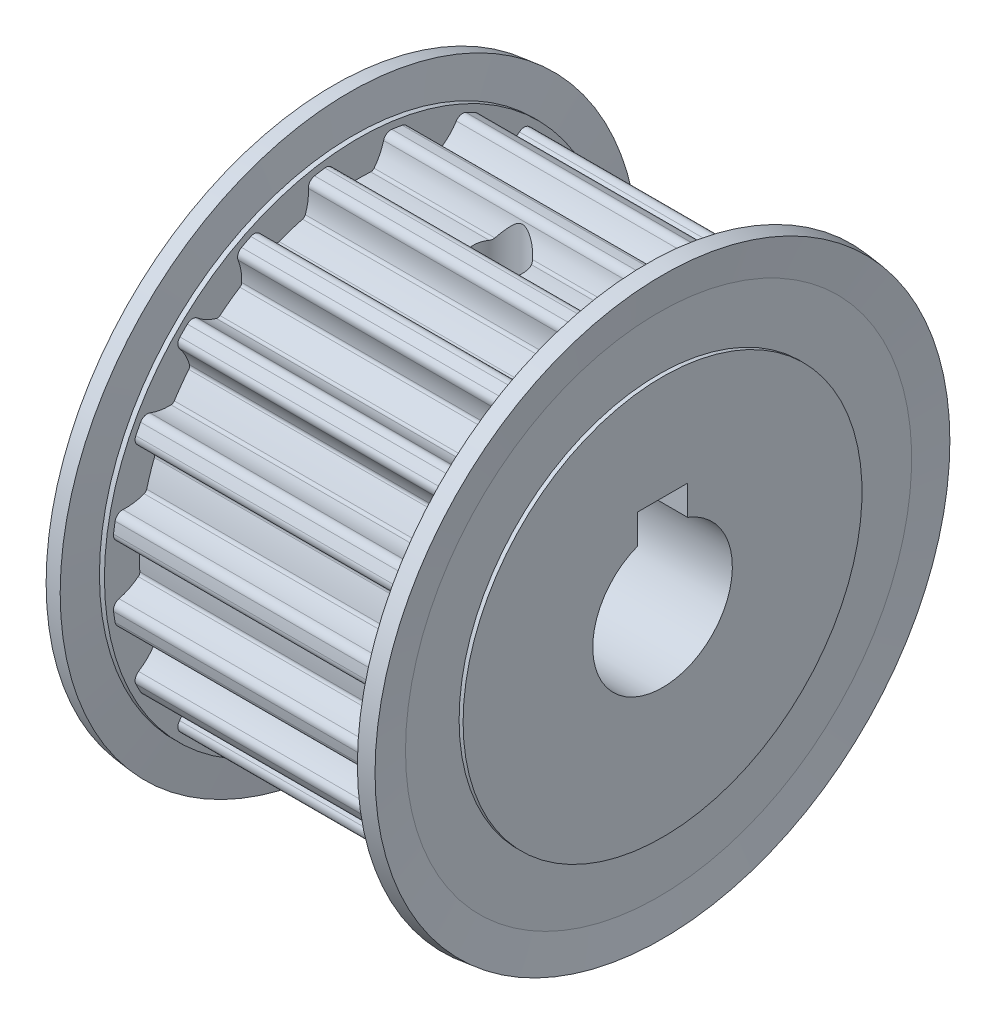
from build123d import *

# Parameters (mm, degrees)
SKETCH_2_W           = 33
SKETCH_2_H           = 29
CUT_EXTRUDE_1_DEPTH  = 28
CUT_EXTRUDE_2_DEPTH  = 28
CUT_EXTRUDE_3_DEPTH  = 28
CUT_EXTRUDE_4_DEPTH  = 28
CUT_EXTRUDE_5_DEPTH  = 28
CUT_EXTRUDE_6_DEPTH  = 28
CUT_EXTRUDE_7_DEPTH  = 28
CUT_EXTRUDE_8_DEPTH  = 28
CUT_EXTRUDE_9_DEPTH  = 28
CUT_EXTRUDE_10_DEPTH = 28
CUT_EXTRUDE_11_DEPTH = 28
CUT_EXTRUDE_12_DEPTH = 28
CUT_EXTRUDE_13_DEPTH = 28
CUT_EXTRUDE_14_DEPTH = 28
CUT_EXTRUDE_15_DEPTH = 28
CUT_EXTRUDE_16_DEPTH = 28
CUT_EXTRUDE_17_DEPTH = 28
CUT_EXTRUDE_18_DEPTH = 28
CUT_EXTRUDE_19_DEPTH = 28
CUT_EXTRUDE_20_DEPTH = 28
SKETCH_24_W          = 2.4585
SKETCH_24_H          = 24.78
SKETCH_26_W          = 5
SKETCH_26_H          = 10
CUT_EXTRUDE_21_DEPTH = 48


with BuildPart() as part:
    # 草图1 → 旋转1 (revolve)
    with BuildSketch(Plane.XY):
        Polygon((0, 20), (0, 7), (48, 7), (48, 10.5), (33, 10.5), (33, 20), (32.6, 20), (32.6, 25.374764584), (32.989854232, 28.82010136), (31.4, 29), (31, 25.465), (30.5, 25.465), (30.5, 24.78), (2.5, 24.78), (2.5, 25.465), (2, 25.465), (1.6, 29), (0.010145768, 28.82010136), (0.4, 25.374764584), (0.4, 20), align=None)
    revolve(axis=Axis((48, 0, 0), (-1, 0, 0)))

    # 草图2 → 切除-旋转1 (revolve, cut)
    with BuildSketch(Plane.XY):
        with Locations((49.5, 14.5)):
            Rectangle(SKETCH_2_W, SKETCH_2_H)
    revolve(axis=Axis((66, 0, 0), (-1, 0, 0)), mode=Mode.SUBTRACT)

    # 草图3 → 切除-拉伸1 (cut)
    with BuildSketch(Plane(origin=(2.5, 0, 0), x_dir=(0, 0, -1), z_dir=(1, 0, 0))):
        with BuildLine():
            Line((3.356654705, 24.551604208), (3.356654705, 33.04))
            Line((3.356654705, 33.04), (-3.356654705, 33.04))
            Line((-3.356654705, 33.04), (-3.356654705, 24.551604208))
            ThreePointArc((-3.356654705, 24.551604208), (-2.837672378, 24.43164347), (-2.529227002, 23.997368575))
            ThreePointArc((-2.529227002, 23.997368575), (-2.151470293, 22.983830343), (-1.575812922, 22.068091041))
            ThreePointArc((-1.575812922, 22.068091041), (-1.425756569, 21.950079795), (-1.238095165, 21.915054651))
            ThreePointArc((-1.238095165, 21.915054651), (-1.7e-08, 21.95), (1.238095131, 21.915054653))
            ThreePointArc((1.238095131, 21.915054653), (1.425756554, 21.950079788), (1.575812922, 22.068091041))
            ThreePointArc((1.575812922, 22.068091041), (2.151470315, 22.983830386), (2.529227027, 23.997368668))
            ThreePointArc((2.529227027, 23.997368668), (2.837672419, 24.431643497), (3.356654705, 24.551604208))
        make_face()
    extrude(amount=CUT_EXTRUDE_1_DEPTH, mode=Mode.SUBTRACT)

    # 草图5 → 切除-拉伸2 (cut)
    with BuildSketch(Plane(origin=(2.5, 0, 0), x_dir=(0, 0, -1), z_dir=(1, 0, 0))):
        with BuildLine():
            Line((-4.394494609, 24.387226516), (-7.017553164, 32.460170647))
            Line((-7.017553164, 32.460170647), (-13.402289825, 30.38564395))
            Line((-13.402289825, 30.38564395), (-10.77923127, 22.312699819))
            ThreePointArc((-10.77923127, 22.312699819), (-10.248579839, 22.358984736), (-9.821032532, 22.041279631))
            ThreePointArc((-9.821032532, 22.041279631), (-9.148564014, 21.194080734), (-8.318102313, 20.501048814))
            ThreePointArc((-8.318102313, 20.501048814), (-8.13892276, 20.435183412), (-7.949622795, 20.459863084))
            ThreePointArc((-7.949622795, 20.459863084), (-6.782923043, 20.875690527), (-5.594625878, 21.225047969))
            ThreePointArc((-5.594625878, 21.225047969), (-5.426972621, 21.31634942), (-5.320728018, 21.47495476))
            ThreePointArc((-5.320728018, 21.47495476), (-5.056224323, 22.523762549), (-5.010156894, 23.60442798))
            ThreePointArc((-5.010156894, 23.60442798), (-4.851006196, 24.112762753), (-4.394494609, 24.387226516))
        make_face()
    extrude(amount=CUT_EXTRUDE_2_DEPTH, mode=Mode.SUBTRACT)

    # 草图6 → 切除-拉伸3 (cut)
    with BuildSketch(Plane(origin=(2.5, 0, 0), x_dir=(0, 0, -1), z_dir=(1, 0, 0))):
        with BuildLine():
            Line((-11.715480173, 21.835657176), (-16.704834035, 28.702913627))
            Line((-16.704834035, 28.702913627), (-22.136015437, 24.756929361))
            Line((-22.136015437, 24.756929361), (-17.146661575, 17.889672911))
            ThreePointArc((-17.146661575, 17.889672911), (-16.656284899, 18.097672793), (-16.15148697, 17.927636666))
            ThreePointArc((-16.15148697, 17.927636666), (-15.250132547, 17.329706834), (-14.246157894, 16.92722109))
            ThreePointArc((-14.246157894, 16.92722109), (-14.055394484, 16.919948897), (-13.882985957, 17.001917566))
            ThreePointArc((-13.882985957, 17.001917566), (-12.901886302, 17.757923016), (-11.879705926, 18.457385706))
            ThreePointArc((-11.879705926, 18.457385706), (-11.748471904, 18.596026252), (-11.696439027, 18.779700282))
            ThreePointArc((-11.696439027, 18.779700282), (-11.768980495, 19.8589119), (-12.05911175, 20.900921419))
            ThreePointArc((-12.05911175, 20.900921419), (-12.064834526, 21.433556788), (-11.715480173, 21.835657176))
        make_face()
    extrude(amount=CUT_EXTRUDE_3_DEPTH, mode=Mode.SUBTRACT)

    # 草图7 → 切除-拉伸4 (cut)
    with BuildSketch(Plane(origin=(2.5, 0, 0), x_dir=(0, 0, -1), z_dir=(1, 0, 0))):
        with BuildLine():
            Line((-17.889672911, 17.146661575), (-24.756929361, 22.136015437))
            Line((-24.756929361, 22.136015437), (-28.702913627, 16.704834035))
            Line((-28.702913627, 16.704834035), (-21.835657176, 11.715480173))
            ThreePointArc((-21.835657176, 11.715480173), (-21.433556743, 12.064834542), (-20.900921329, 12.059111714))
            ThreePointArc((-20.900921329, 12.059111714), (-19.858911853, 11.768980487), (-18.779700282, 11.696439027))
            ThreePointArc((-18.779700282, 11.696439027), (-18.596026267, 11.748471896), (-18.457385725, 11.879705898))
            ThreePointArc((-18.457385725, 11.879705898), (-17.757923037, 12.901886274), (-17.001917588, 13.88298593))
            ThreePointArc((-17.001917588, 13.88298593), (-16.919948901, 14.055394468), (-16.92722109, 14.246157894))
            ThreePointArc((-16.92722109, 14.246157894), (-17.329706857, 15.25013259), (-17.927636727, 16.151487044))
            ThreePointArc((-17.927636727, 16.151487044), (-18.097672791, 16.656284948), (-17.889672911, 17.146661575))
        make_face()
    extrude(amount=CUT_EXTRUDE_4_DEPTH, mode=Mode.SUBTRACT)

    # 草图8 → 切除-拉伸5 (cut)
    with BuildSketch(Plane(origin=(2.5, 0, 0), x_dir=(0, 0, -1), z_dir=(1, 0, 0))):
        with BuildLine():
            Line((-22.312699819, 10.77923127), (-30.38564395, 13.402289825))
            Line((-30.38564395, 13.402289825), (-32.460170647, 7.017553164))
            Line((-32.460170647, 7.017553164), (-24.387226516, 4.394494609))
            ThreePointArc((-24.387226516, 4.394494609), (-24.112762715, 4.851006226), (-23.604427883, 5.010156888))
            ThreePointArc((-23.604427883, 5.010156888), (-22.523762501, 5.05622433), (-21.47495476, 5.320728018))
            ThreePointArc((-21.47495476, 5.320728018), (-21.316349432, 5.426972609), (-21.225047978, 5.594625845))
            ThreePointArc((-21.225047978, 5.594625845), (-20.875690538, 6.78292301), (-20.459863096, 7.949622763))
            ThreePointArc((-20.459863096, 7.949622763), (-20.435183411, 8.138922743), (-20.501048814, 8.318102313))
            ThreePointArc((-20.501048814, 8.318102313), (-21.194080768, 9.148564048), (-22.041279712, 9.821032584))
            ThreePointArc((-22.041279712, 9.821032584), (-22.35898475, 10.248579886), (-22.312699819, 10.77923127))
        make_face()
    extrude(amount=CUT_EXTRUDE_5_DEPTH, mode=Mode.SUBTRACT)

    # 草图9 → 切除-拉伸6 (cut)
    with BuildSketch(Plane(origin=(2.5, 0, 0), x_dir=(0, 0, -1), z_dir=(1, 0, 0))):
        with BuildLine():
            Line((-24.551604208, 3.356654705), (-33.04, 3.356654705))
            Line((-33.04, 3.356654705), (-33.04, -3.356654705))
            Line((-33.04, -3.356654705), (-24.551604208, -3.356654705))
            ThreePointArc((-24.551604208, -3.356654705), (-24.43164347, -2.837672378), (-23.997368575, -2.529227002))
            ThreePointArc((-23.997368575, -2.529227002), (-22.983830343, -2.151470293), (-22.068091041, -1.575812922))
            ThreePointArc((-22.068091041, -1.575812922), (-21.950079795, -1.425756569), (-21.915054651, -1.238095165))
            ThreePointArc((-21.915054651, -1.238095165), (-21.95, -1.7e-08), (-21.915054653, 1.238095131))
            ThreePointArc((-21.915054653, 1.238095131), (-21.950079788, 1.425756554), (-22.068091041, 1.575812922))
            ThreePointArc((-22.068091041, 1.575812922), (-22.983830386, 2.151470315), (-23.997368668, 2.529227027))
            ThreePointArc((-23.997368668, 2.529227027), (-24.431643497, 2.837672419), (-24.551604208, 3.356654705))
        make_face()
    extrude(amount=CUT_EXTRUDE_6_DEPTH, mode=Mode.SUBTRACT)

    # 草图10 → 切除-拉伸7 (cut)
    with BuildSketch(Plane(origin=(2.5, 0, 0), x_dir=(0, 0, -1), z_dir=(1, 0, 0))):
        with BuildLine():
            Line((-24.387226516, -4.394494609), (-32.460170647, -7.017553164))
            Line((-32.460170647, -7.017553164), (-30.38564395, -13.402289825))
            Line((-30.38564395, -13.402289825), (-22.312699819, -10.77923127))
            ThreePointArc((-22.312699819, -10.77923127), (-22.358984736, -10.248579839), (-22.041279631, -9.821032532))
            ThreePointArc((-22.041279631, -9.821032532), (-21.194080734, -9.148564014), (-20.501048814, -8.318102313))
            ThreePointArc((-20.501048814, -8.318102313), (-20.435183412, -8.13892276), (-20.459863084, -7.949622795))
            ThreePointArc((-20.459863084, -7.949622795), (-20.875690527, -6.782923043), (-21.225047969, -5.594625878))
            ThreePointArc((-21.225047969, -5.594625878), (-21.31634942, -5.426972621), (-21.47495476, -5.320728018))
            ThreePointArc((-21.47495476, -5.320728018), (-22.523762549, -5.056224323), (-23.60442798, -5.010156894))
            ThreePointArc((-23.60442798, -5.010156894), (-24.112762753, -4.851006196), (-24.387226516, -4.394494609))
        make_face()
    extrude(amount=CUT_EXTRUDE_7_DEPTH, mode=Mode.SUBTRACT)

    # 草图11 → 切除-拉伸8 (cut)
    with BuildSketch(Plane(origin=(2.5, 0, 0), x_dir=(0, 0, -1), z_dir=(1, 0, 0))):
        with BuildLine():
            Line((-21.835657176, -11.715480173), (-28.702913627, -16.704834035))
            Line((-28.702913627, -16.704834035), (-24.756929361, -22.136015437))
            Line((-24.756929361, -22.136015437), (-17.889672911, -17.146661575))
            ThreePointArc((-17.889672911, -17.146661575), (-18.097672793, -16.656284899), (-17.927636666, -16.15148697))
            ThreePointArc((-17.927636666, -16.15148697), (-17.329706834, -15.250132547), (-16.92722109, -14.246157894))
            ThreePointArc((-16.92722109, -14.246157894), (-16.919948897, -14.055394484), (-17.001917566, -13.882985957))
            ThreePointArc((-17.001917566, -13.882985957), (-17.757923016, -12.901886302), (-18.457385706, -11.879705926))
            ThreePointArc((-18.457385706, -11.879705926), (-18.596026252, -11.748471904), (-18.779700282, -11.696439027))
            ThreePointArc((-18.779700282, -11.696439027), (-19.8589119, -11.768980495), (-20.900921419, -12.05911175))
            ThreePointArc((-20.900921419, -12.05911175), (-21.433556788, -12.064834526), (-21.835657176, -11.715480173))
        make_face()
    extrude(amount=CUT_EXTRUDE_8_DEPTH, mode=Mode.SUBTRACT)

    # 草图12 → 切除-拉伸9 (cut)
    with BuildSketch(Plane(origin=(2.5, 0, 0), x_dir=(0, 0, -1), z_dir=(1, 0, 0))):
        with BuildLine():
            Line((-17.146661575, -17.889672911), (-22.136015437, -24.756929361))
            Line((-22.136015437, -24.756929361), (-16.704834035, -28.702913627))
            Line((-16.704834035, -28.702913627), (-11.715480173, -21.835657176))
            ThreePointArc((-11.715480173, -21.835657176), (-12.064834542, -21.433556743), (-12.059111714, -20.900921329))
            ThreePointArc((-12.059111714, -20.900921329), (-11.768980487, -19.858911853), (-11.696439027, -18.779700282))
            ThreePointArc((-11.696439027, -18.779700282), (-11.748471896, -18.596026267), (-11.879705898, -18.457385725))
            ThreePointArc((-11.879705898, -18.457385725), (-12.901886274, -17.757923037), (-13.88298593, -17.001917588))
            ThreePointArc((-13.88298593, -17.001917588), (-14.055394468, -16.919948901), (-14.246157894, -16.92722109))
            ThreePointArc((-14.246157894, -16.92722109), (-15.25013259, -17.329706857), (-16.151487044, -17.927636727))
            ThreePointArc((-16.151487044, -17.927636727), (-16.656284948, -18.097672791), (-17.146661575, -17.889672911))
        make_face()
    extrude(amount=CUT_EXTRUDE_9_DEPTH, mode=Mode.SUBTRACT)

    # 草图13 → 切除-拉伸10 (cut)
    with BuildSketch(Plane(origin=(2.5, 0, 0), x_dir=(0, 0, -1), z_dir=(1, 0, 0))):
        with BuildLine():
            Line((-10.77923127, -22.312699819), (-13.402289825, -30.38564395))
            Line((-13.402289825, -30.38564395), (-7.017553164, -32.460170647))
            Line((-7.017553164, -32.460170647), (-4.394494609, -24.387226516))
            ThreePointArc((-4.394494609, -24.387226516), (-4.851006226, -24.112762715), (-5.010156888, -23.604427883))
            ThreePointArc((-5.010156888, -23.604427883), (-5.05622433, -22.523762501), (-5.320728018, -21.47495476))
            ThreePointArc((-5.320728018, -21.47495476), (-5.426972609, -21.316349432), (-5.594625845, -21.225047978))
            ThreePointArc((-5.594625845, -21.225047978), (-6.78292301, -20.875690538), (-7.949622763, -20.459863096))
            ThreePointArc((-7.949622763, -20.459863096), (-8.138922743, -20.435183411), (-8.318102313, -20.501048814))
            ThreePointArc((-8.318102313, -20.501048814), (-9.148564048, -21.194080768), (-9.821032584, -22.041279712))
            ThreePointArc((-9.821032584, -22.041279712), (-10.248579886, -22.35898475), (-10.77923127, -22.312699819))
        make_face()
    extrude(amount=CUT_EXTRUDE_10_DEPTH, mode=Mode.SUBTRACT)

    # 草图14 → 切除-拉伸11 (cut)
    with BuildSketch(Plane(origin=(2.5, 0, 0), x_dir=(0, 0, -1), z_dir=(1, 0, 0))):
        with BuildLine():
            Line((-3.356654705, -24.551604208), (-3.356654705, -33.04))
            Line((-3.356654705, -33.04), (3.356654705, -33.04))
            Line((3.356654705, -33.04), (3.356654705, -24.551604208))
            ThreePointArc((3.356654705, -24.551604208), (2.837672378, -24.43164347), (2.529227002, -23.997368575))
            ThreePointArc((2.529227002, -23.997368575), (2.151470293, -22.983830343), (1.575812922, -22.068091041))
            ThreePointArc((1.575812922, -22.068091041), (1.425756569, -21.950079795), (1.238095165, -21.915054651))
            ThreePointArc((1.238095165, -21.915054651), (1.7e-08, -21.95), (-1.238095131, -21.915054653))
            ThreePointArc((-1.238095131, -21.915054653), (-1.425756554, -21.950079788), (-1.575812922, -22.068091041))
            ThreePointArc((-1.575812922, -22.068091041), (-2.151470315, -22.983830386), (-2.529227027, -23.997368668))
            ThreePointArc((-2.529227027, -23.997368668), (-2.837672419, -24.431643497), (-3.356654705, -24.551604208))
        make_face()
    extrude(amount=CUT_EXTRUDE_11_DEPTH, mode=Mode.SUBTRACT)

    # 草图15 → 切除-拉伸12 (cut)
    with BuildSketch(Plane(origin=(2.5, 0, 0), x_dir=(0, 0, -1), z_dir=(1, 0, 0))):
        with BuildLine():
            Line((4.394494609, -24.387226516), (7.017553164, -32.460170647))
            Line((7.017553164, -32.460170647), (13.402289825, -30.38564395))
            Line((13.402289825, -30.38564395), (10.77923127, -22.312699819))
            ThreePointArc((10.77923127, -22.312699819), (10.248579839, -22.358984736), (9.821032532, -22.041279631))
            ThreePointArc((9.821032532, -22.041279631), (9.148564014, -21.194080734), (8.318102313, -20.501048814))
            ThreePointArc((8.318102313, -20.501048814), (8.13892276, -20.435183412), (7.949622795, -20.459863084))
            ThreePointArc((7.949622795, -20.459863084), (6.782923043, -20.875690527), (5.594625878, -21.225047969))
            ThreePointArc((5.594625878, -21.225047969), (5.426972621, -21.31634942), (5.320728018, -21.47495476))
            ThreePointArc((5.320728018, -21.47495476), (5.056224323, -22.523762549), (5.010156894, -23.60442798))
            ThreePointArc((5.010156894, -23.60442798), (4.851006196, -24.112762753), (4.394494609, -24.387226516))
        make_face()
    extrude(amount=CUT_EXTRUDE_12_DEPTH, mode=Mode.SUBTRACT)

    # 草图16 → 切除-拉伸13 (cut)
    with BuildSketch(Plane(origin=(2.5, 0, 0), x_dir=(0, 0, -1), z_dir=(1, 0, 0))):
        with BuildLine():
            Line((11.715480173, -21.835657176), (16.704834035, -28.702913627))
            Line((16.704834035, -28.702913627), (22.136015437, -24.756929361))
            Line((22.136015437, -24.756929361), (17.146661575, -17.889672911))
            ThreePointArc((17.146661575, -17.889672911), (16.656284899, -18.097672793), (16.15148697, -17.927636666))
            ThreePointArc((16.15148697, -17.927636666), (15.250132547, -17.329706834), (14.246157894, -16.92722109))
            ThreePointArc((14.246157894, -16.92722109), (14.055394484, -16.919948897), (13.882985957, -17.001917566))
            ThreePointArc((13.882985957, -17.001917566), (12.901886302, -17.757923016), (11.879705926, -18.457385706))
            ThreePointArc((11.879705926, -18.457385706), (11.748471904, -18.596026252), (11.696439027, -18.779700282))
            ThreePointArc((11.696439027, -18.779700282), (11.768980495, -19.8589119), (12.05911175, -20.900921419))
            ThreePointArc((12.05911175, -20.900921419), (12.064834526, -21.433556788), (11.715480173, -21.835657176))
        make_face()
    extrude(amount=CUT_EXTRUDE_13_DEPTH, mode=Mode.SUBTRACT)

    # 草图17 → 切除-拉伸14 (cut)
    with BuildSketch(Plane(origin=(2.5, 0, 0), x_dir=(0, 0, -1), z_dir=(1, 0, 0))):
        with BuildLine():
            Line((17.889672911, -17.146661575), (24.756929361, -22.136015437))
            Line((24.756929361, -22.136015437), (28.702913627, -16.704834035))
            Line((28.702913627, -16.704834035), (21.835657176, -11.715480173))
            ThreePointArc((21.835657176, -11.715480173), (21.433556743, -12.064834542), (20.900921329, -12.059111714))
            ThreePointArc((20.900921329, -12.059111714), (19.858911853, -11.768980487), (18.779700282, -11.696439027))
            ThreePointArc((18.779700282, -11.696439027), (18.596026267, -11.748471896), (18.457385725, -11.879705898))
            ThreePointArc((18.457385725, -11.879705898), (17.757923037, -12.901886274), (17.001917588, -13.88298593))
            ThreePointArc((17.001917588, -13.88298593), (16.919948901, -14.055394468), (16.92722109, -14.246157894))
            ThreePointArc((16.92722109, -14.246157894), (17.329706857, -15.25013259), (17.927636727, -16.151487044))
            ThreePointArc((17.927636727, -16.151487044), (18.097672791, -16.656284948), (17.889672911, -17.146661575))
        make_face()
    extrude(amount=CUT_EXTRUDE_14_DEPTH, mode=Mode.SUBTRACT)

    # 草图18 → 切除-拉伸15 (cut)
    with BuildSketch(Plane(origin=(2.5, 0, 0), x_dir=(0, 0, -1), z_dir=(1, 0, 0))):
        with BuildLine():
            Line((22.312699819, -10.77923127), (30.38564395, -13.402289825))
            Line((30.38564395, -13.402289825), (32.460170647, -7.017553164))
            Line((32.460170647, -7.017553164), (24.387226516, -4.394494609))
            ThreePointArc((24.387226516, -4.394494609), (24.112762715, -4.851006226), (23.604427883, -5.010156888))
            ThreePointArc((23.604427883, -5.010156888), (22.523762501, -5.05622433), (21.47495476, -5.320728018))
            ThreePointArc((21.47495476, -5.320728018), (21.316349432, -5.426972609), (21.225047978, -5.594625845))
            ThreePointArc((21.225047978, -5.594625845), (20.875690538, -6.78292301), (20.459863096, -7.949622763))
            ThreePointArc((20.459863096, -7.949622763), (20.435183411, -8.138922743), (20.501048814, -8.318102313))
            ThreePointArc((20.501048814, -8.318102313), (21.194080768, -9.148564048), (22.041279712, -9.821032584))
            ThreePointArc((22.041279712, -9.821032584), (22.35898475, -10.248579886), (22.312699819, -10.77923127))
        make_face()
    extrude(amount=CUT_EXTRUDE_15_DEPTH, mode=Mode.SUBTRACT)

    # 草图19 → 切除-拉伸16 (cut)
    with BuildSketch(Plane(origin=(2.5, 0, 0), x_dir=(0, 0, -1), z_dir=(1, 0, 0))):
        with BuildLine():
            Line((24.551604208, -3.356654705), (33.04, -3.356654705))
            Line((33.04, -3.356654705), (33.04, 3.356654705))
            Line((33.04, 3.356654705), (24.551604208, 3.356654705))
            ThreePointArc((24.551604208, 3.356654705), (24.43164347, 2.837672378), (23.997368575, 2.529227002))
            ThreePointArc((23.997368575, 2.529227002), (22.983830343, 2.151470293), (22.068091041, 1.575812922))
            ThreePointArc((22.068091041, 1.575812922), (21.950079795, 1.425756569), (21.915054651, 1.238095165))
            ThreePointArc((21.915054651, 1.238095165), (21.95, 1.7e-08), (21.915054653, -1.238095131))
            ThreePointArc((21.915054653, -1.238095131), (21.950079788, -1.425756554), (22.068091041, -1.575812922))
            ThreePointArc((22.068091041, -1.575812922), (22.983830386, -2.151470315), (23.997368668, -2.529227027))
            ThreePointArc((23.997368668, -2.529227027), (24.431643497, -2.837672419), (24.551604208, -3.356654705))
        make_face()
    extrude(amount=CUT_EXTRUDE_16_DEPTH, mode=Mode.SUBTRACT)

    # 草图20 → 切除-拉伸17 (cut)
    with BuildSketch(Plane(origin=(2.5, 0, 0), x_dir=(0, 0, -1), z_dir=(1, 0, 0))):
        with BuildLine():
            Line((24.387226516, 4.394494609), (32.460170647, 7.017553164))
            Line((32.460170647, 7.017553164), (30.38564395, 13.402289825))
            Line((30.38564395, 13.402289825), (22.312699819, 10.77923127))
            ThreePointArc((22.312699819, 10.77923127), (22.358984736, 10.248579839), (22.041279631, 9.821032532))
            ThreePointArc((22.041279631, 9.821032532), (21.194080734, 9.148564014), (20.501048814, 8.318102313))
            ThreePointArc((20.501048814, 8.318102313), (20.435183412, 8.13892276), (20.459863084, 7.949622795))
            ThreePointArc((20.459863084, 7.949622795), (20.875690527, 6.782923043), (21.225047969, 5.594625878))
            ThreePointArc((21.225047969, 5.594625878), (21.31634942, 5.426972621), (21.47495476, 5.320728018))
            ThreePointArc((21.47495476, 5.320728018), (22.523762549, 5.056224323), (23.60442798, 5.010156894))
            ThreePointArc((23.60442798, 5.010156894), (24.112762753, 4.851006196), (24.387226516, 4.394494609))
        make_face()
    extrude(amount=CUT_EXTRUDE_17_DEPTH, mode=Mode.SUBTRACT)

    # 草图21 → 切除-拉伸18 (cut)
    with BuildSketch(Plane(origin=(2.5, 0, 0), x_dir=(0, 0, -1), z_dir=(1, 0, 0))):
        with BuildLine():
            Line((21.835657176, 11.715480173), (28.702913627, 16.704834035))
            Line((28.702913627, 16.704834035), (24.756929361, 22.136015437))
            Line((24.756929361, 22.136015437), (17.889672911, 17.146661575))
            ThreePointArc((17.889672911, 17.146661575), (18.097672793, 16.656284899), (17.927636666, 16.15148697))
            ThreePointArc((17.927636666, 16.15148697), (17.329706834, 15.250132547), (16.92722109, 14.246157894))
            ThreePointArc((16.92722109, 14.246157894), (16.919948897, 14.055394484), (17.001917566, 13.882985957))
            ThreePointArc((17.001917566, 13.882985957), (17.757923016, 12.901886302), (18.457385706, 11.879705926))
            ThreePointArc((18.457385706, 11.879705926), (18.596026252, 11.748471904), (18.779700282, 11.696439027))
            ThreePointArc((18.779700282, 11.696439027), (19.8589119, 11.768980495), (20.900921419, 12.05911175))
            ThreePointArc((20.900921419, 12.05911175), (21.433556788, 12.064834526), (21.835657176, 11.715480173))
        make_face()
    extrude(amount=CUT_EXTRUDE_18_DEPTH, mode=Mode.SUBTRACT)

    # 草图22 → 切除-拉伸19 (cut)
    with BuildSketch(Plane(origin=(2.5, 0, 0), x_dir=(0, 0, -1), z_dir=(1, 0, 0))):
        with BuildLine():
            Line((17.146661575, 17.889672911), (22.136015437, 24.756929361))
            Line((22.136015437, 24.756929361), (16.704834035, 28.702913627))
            Line((16.704834035, 28.702913627), (11.715480173, 21.835657176))
            ThreePointArc((11.715480173, 21.835657176), (12.064834542, 21.433556743), (12.059111714, 20.900921329))
            ThreePointArc((12.059111714, 20.900921329), (11.768980487, 19.858911853), (11.696439027, 18.779700282))
            ThreePointArc((11.696439027, 18.779700282), (11.748471896, 18.596026267), (11.879705898, 18.457385725))
            ThreePointArc((11.879705898, 18.457385725), (12.901886274, 17.757923037), (13.88298593, 17.001917588))
            ThreePointArc((13.88298593, 17.001917588), (14.055394468, 16.919948901), (14.246157894, 16.92722109))
            ThreePointArc((14.246157894, 16.92722109), (15.25013259, 17.329706857), (16.151487044, 17.927636727))
            ThreePointArc((16.151487044, 17.927636727), (16.656284948, 18.097672791), (17.146661575, 17.889672911))
        make_face()
    extrude(amount=CUT_EXTRUDE_19_DEPTH, mode=Mode.SUBTRACT)

    # 草图23 → 切除-拉伸20 (cut)
    with BuildSketch(Plane(origin=(2.5, 0, 0), x_dir=(0, 0, -1), z_dir=(1, 0, 0))):
        with BuildLine():
            Line((10.77923127, 22.312699819), (13.402289825, 30.38564395))
            Line((13.402289825, 30.38564395), (7.017553164, 32.460170647))
            Line((7.017553164, 32.460170647), (4.394494609, 24.387226516))
            ThreePointArc((4.394494609, 24.387226516), (4.851006226, 24.112762715), (5.010156888, 23.604427883))
            ThreePointArc((5.010156888, 23.604427883), (5.05622433, 22.523762501), (5.320728018, 21.47495476))
            ThreePointArc((5.320728018, 21.47495476), (5.426972609, 21.316349432), (5.594625845, 21.225047978))
            ThreePointArc((5.594625845, 21.225047978), (6.78292301, 20.875690538), (7.949622763, 20.459863096))
            ThreePointArc((7.949622763, 20.459863096), (8.138922743, 20.435183411), (8.318102313, 20.501048814))
            ThreePointArc((8.318102313, 20.501048814), (9.148564048, 21.194080768), (9.821032584, 22.041279712))
            ThreePointArc((9.821032584, 22.041279712), (10.248579886, 22.35898475), (10.77923127, 22.312699819))
        make_face()
    extrude(amount=CUT_EXTRUDE_20_DEPTH, mode=Mode.SUBTRACT)

    # 草图24 → 切除-旋转2 (revolve, cut)
    with BuildSketch(Plane(origin=(16.5, 0, 0), x_dir=(0, 0, -1), z_dir=(1, 0, 0))):
        with Locations((1.22925, 12.39)):
            Rectangle(SKETCH_24_W, SKETCH_24_H)
    revolve(axis=Axis((16.5, 12.3, 0), (0, 1, 0)), mode=Mode.SUBTRACT)

    # 草图25 → 切除-旋转3 (revolve, cut)
    with BuildSketch(Plane(origin=(16.5, 0, 0), x_dir=(0, 0, -1), z_dir=(1, 0, 0))):
        Polygon((21.460109506, -12.39), (20.230859506, -14.519123455), (-1.22925, -2.129123455), (0, 0), align=None)
    revolve(axis=Axis((16.5, -4.5, -7.794228634), (0, -0.4999999999999998, -0.8660254037844388)), mode=Mode.SUBTRACT)

    # 草图26 → 切除-拉伸21 (cut)
    with BuildSketch(Plane(origin=(0, 0, 0), x_dir=(0, 0, -1), z_dir=(1, 0, 0))):
        with Locations((0, 4.5)):
            Rectangle(SKETCH_26_W, SKETCH_26_H)
    extrude(amount=CUT_EXTRUDE_21_DEPTH, mode=Mode.SUBTRACT)


solid = part.part
